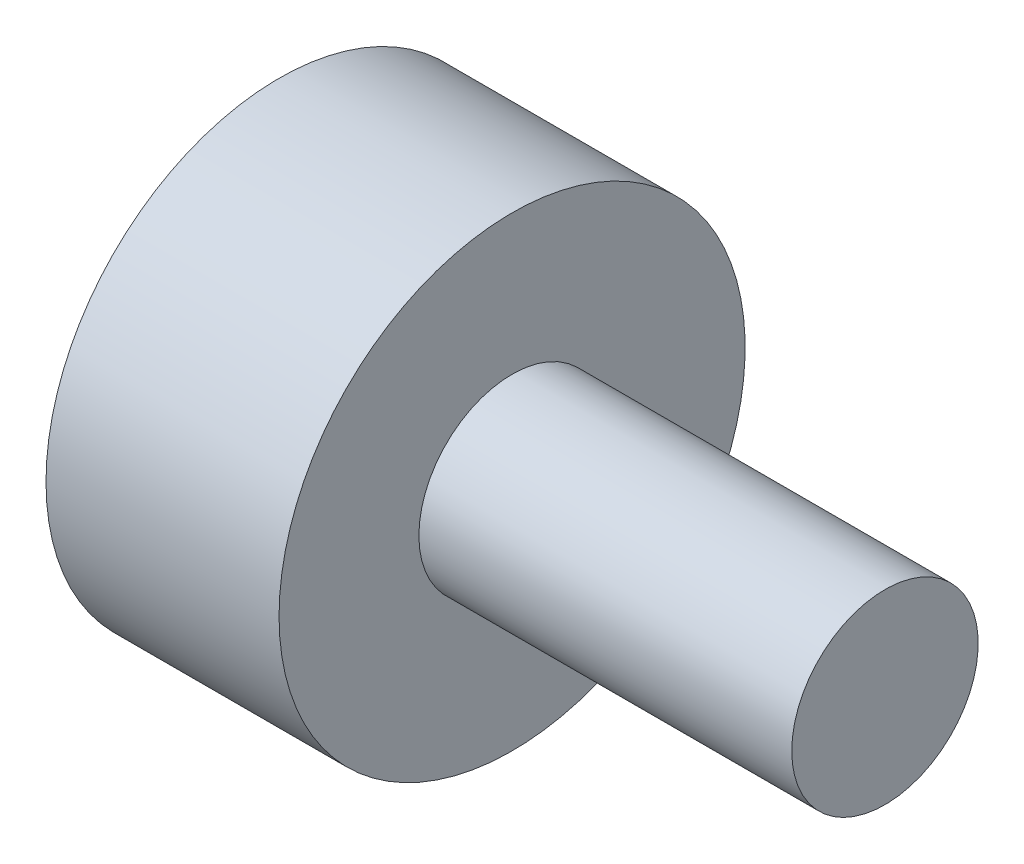
from build123d import *


with BuildPart() as part:
    # Sketch1 → Revolve1 (revolve)
    with BuildSketch(Plane.XY, mode=Mode.PRIVATE) as revolve1_sk:
        Polygon((0, 12), (0, 25), (25, 25), (25, 10), (65, 10), (65, 0), (40, 0), (40, 7), (12, 7), (12, 12), align=None)
    revolve(revolve1_sk.sketch.rotate(Axis((0, 0, 0), (1, 0, 0)), 90), axis=Axis((0, 0, 0), (1, 0, 0)))


solid = part.part
